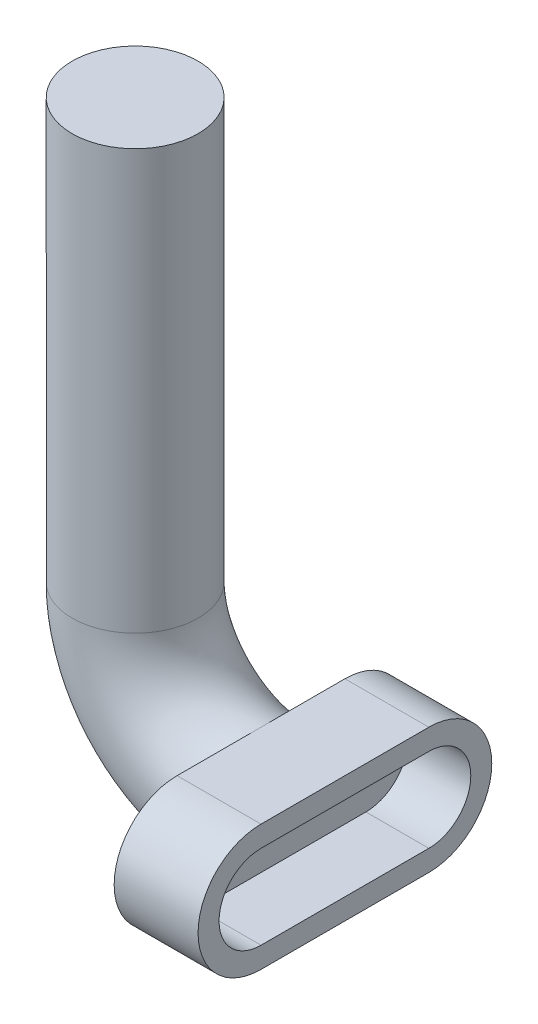
from build123d import *

# Parameters (mm, degrees)
BOSS_EXTRUDE1_DEPTH = 25.4
SHELL1_T            = -6.35
SKETCH7_R           = 19.05


with BuildPart() as part:
    # Sketch1 → Boss-Extrude1 (new body)
    with BuildSketch(Plane(origin=(0, 0, 0), x_dir=(0, 0, -1), z_dir=(1, 0, 0))):
        with BuildLine():
            Line((-25.4, 19.05), (25.4, 19.05))
            ThreePointArc((25.4, 19.05), (44.45, 0), (25.4, -19.05))
            Line((25.4, -19.05), (-25.4, -19.05))
            ThreePointArc((-25.4, -19.05), (-44.45, 0), (-25.4, 19.05))
        make_face()
    extrude(amount=BOSS_EXTRUDE1_DEPTH)

    # Shell1
    shell1_openings = [part.faces().sort_by_distance(p)[0] for p in [
        (25.4, 0, 0),
    ]]
    offset(amount=SHELL1_T, openings=shell1_openings, kind=Kind.INTERSECTION)

    # Sweep1: sweep along a path in Sketch3
    with BuildLine(Plane.XY) as sweep1_path:
        Line((-38.1, 165.1), (-38.1, 38.1))
        ThreePointArc((-38.1, 38.1), (-26.940768363, 11.159231637), (0, 0))
    # Sketch7 → Sweep1 (sweep)
    with BuildSketch(Plane.ZY):
        Circle(SKETCH7_R)
    sweep(path=sweep1_path.line)


solid = part.part
